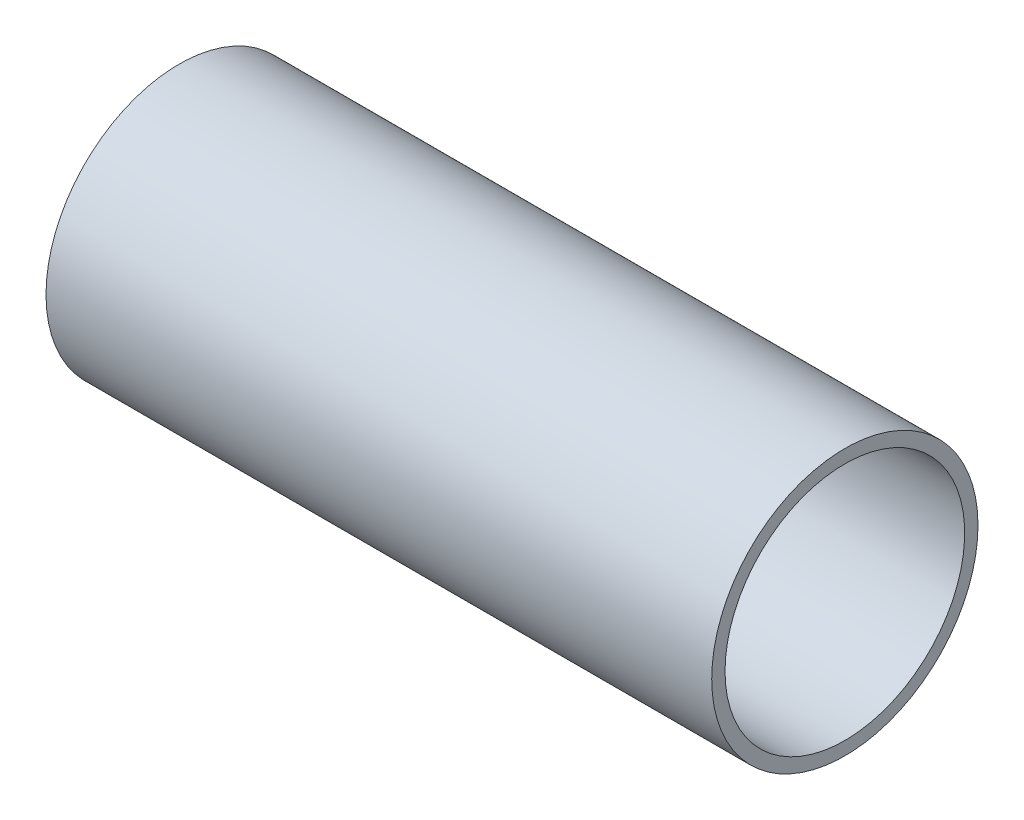
from build123d import *

# Parameters (mm, degrees)
SKETCH2_R           = 254
SKETCH2_R_2         = 228.6
BOSS_EXTRUDE1_DEPTH = 635


with BuildPart() as part:
    # Sketch2 → Boss-Extrude1 (new, symmetric)
    with BuildSketch(Plane(origin=(0, 0, 0), x_dir=(0, 0, -1), z_dir=(1, 0, 0))):
        with Locations(Location((0, 0, 0), (0, 0, 180))):
            Circle(SKETCH2_R)
        with Locations(Location((0, 0, 0), (0, 0, 180))):
            Circle(SKETCH2_R_2, mode=Mode.SUBTRACT)
    extrude(amount=BOSS_EXTRUDE1_DEPTH, both=True)


solid = part.part
